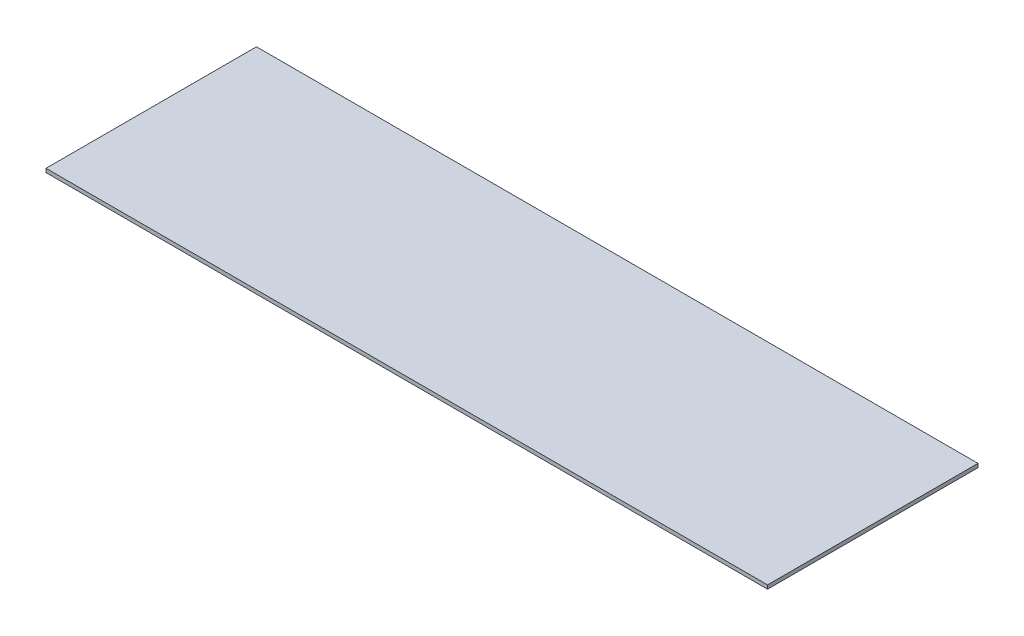
from build123d import *

# Parameters (mm, degrees)
SKETCH1_W           = 2438.4
SKETCH1_H           = 711.2
BOSS_EXTRUDE1_DEPTH = 12.7


with BuildPart() as part:
    # Sketch1 → Boss-Extrude1 (new body)
    with BuildSketch(Plane(origin=(0, 0, 0), x_dir=(1, 0, 0), z_dir=(0, 1, 0))):
        Rectangle(SKETCH1_W, SKETCH1_H)
    extrude(amount=BOSS_EXTRUDE1_DEPTH)


solid = part.part
